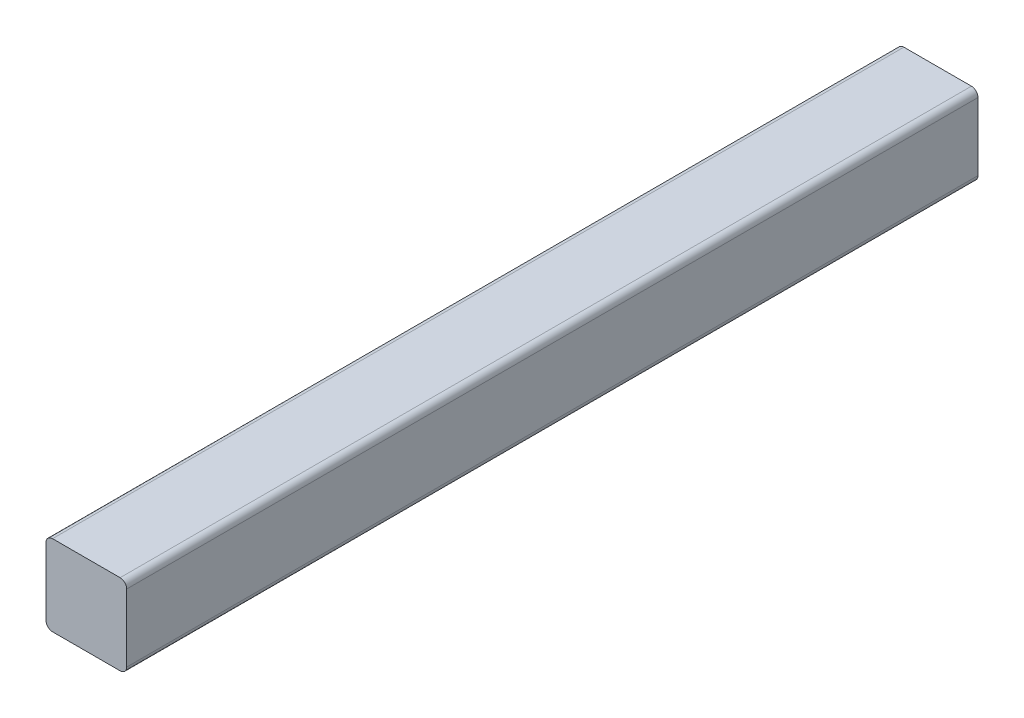
from build123d import *

# Parameters (mm, degrees)
BOSS_EXTRUDE1_DEPTH = 32.5
SKETCH4_R           = 0.5
BOSS_EXTRUDE2_DEPTH = 1


with BuildPart() as part:
    # Sketch2 → Boss-Extrude1 (new body)
    with BuildSketch(Plane.XY):
        with BuildLine():
            Line((0.25, 0), (2.83, 0))
            ThreePointArc((2.83, 0), (3.006776695, 0.073223305), (3.08, 0.25))
            Line((3.08, 0.25), (3.08, 2.83))
            ThreePointArc((3.08, 2.83), (3.006776695, 3.006776695), (2.83, 3.08))
            Line((2.83, 3.08), (0.25, 3.08))
            ThreePointArc((0.25, 3.08), (0.073223305, 3.006776695), (0, 2.83))
            Line((0, 2.83), (0, 0.25))
            ThreePointArc((0, 0.25), (0.073223305, 0.073223305), (0.25, 0))
        make_face()
    extrude(amount=BOSS_EXTRUDE1_DEPTH)

    # Sketch4 → Boss-Extrude2 (add)
    with BuildSketch(Plane(origin=(0, 0, 0), x_dir=(-1, 0, 0), z_dir=(0, 0, -1))):
        with Locations(Location((-1.54, 1.54, 0), (0, 0, 180))):
            Circle(SKETCH4_R)
    extrude(amount=BOSS_EXTRUDE2_DEPTH)


solid = part.part
